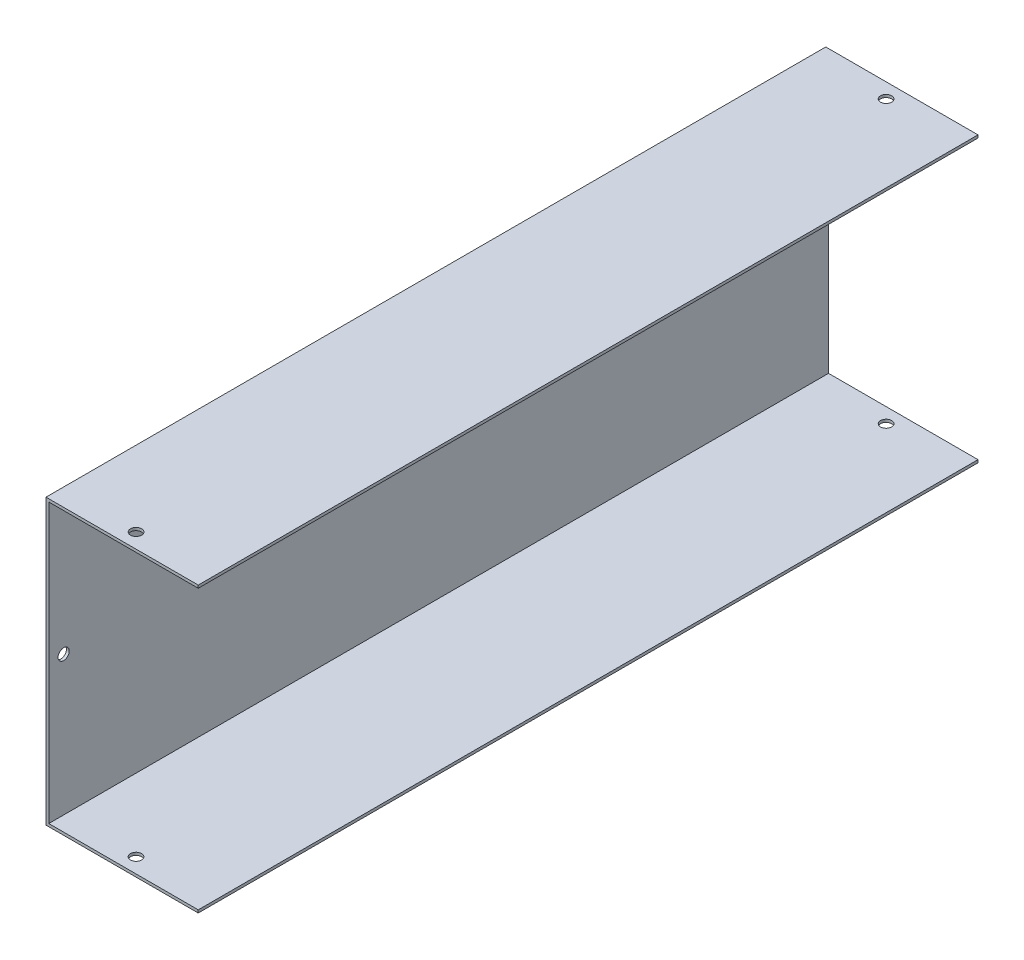
from build123d import *

# Parameters (mm, degrees)
SKETCH1_W           = 82
SKETCH1_H           = 153
BOSS_EXTRUDE1_DEPTH = 420
SHELL1_T            = -1.5
SKETCH4_R           = 3
CUT_EXTRUDE1_DEPTH  = 154
CUT_EXTRUDE2_REACH  = 436.714
SKETCH5_R           = 3


with BuildPart() as part:
    # Sketch1 → Boss-Extrude1 (new body)
    with BuildSketch(Plane.XY):
        Rectangle(SKETCH1_W, SKETCH1_H)
    extrude(amount=BOSS_EXTRUDE1_DEPTH)

    # Shell1
    shell1_openings = [part.faces().sort_by_distance(p)[0] for p in [
        (0, 0, 0),
        (41, 0, 210),
        (0, 0, 420),
    ]]
    offset(amount=SHELL1_T, openings=shell1_openings, kind=Kind.INTERSECTION)

    # Sketch4 → Cut-Extrude1 (cut)
    with BuildSketch(Plane(origin=(0, 76.5, 0), x_dir=(1, 0, 0), z_dir=(0, 1, 0))):
        with Locations((-0.5, -8)):
            Circle(SKETCH4_R)
        with Locations((-0.5, -412)):
            Circle(SKETCH4_R)
    extrude(amount=-CUT_EXTRUDE1_DEPTH, mode=Mode.SUBTRACT)

    # Sketch5 → Cut-Extrude2 (cut, up to next)
    with BuildSketch(Plane.ZY.offset(41), mode=Mode.PRIVATE) as cut_extrude2_sk1:
        with Locations((8, 0)):
            Circle(SKETCH5_R)
    cut_extrude2_tool1 = extrude(cut_extrude2_sk1.sketch, amount=-CUT_EXTRUDE2_REACH, mode=Mode.PRIVATE) & part.part
    # Sketch5 → Cut-Extrude2 (cut, up to next)
    with BuildSketch(Plane.ZY.offset(41), mode=Mode.PRIVATE) as cut_extrude2_sk2:
        with Locations((412, 0)):
            Circle(SKETCH5_R)
    cut_extrude2_tool2 = extrude(cut_extrude2_sk2.sketch, amount=-CUT_EXTRUDE2_REACH, mode=Mode.PRIVATE) & part.part
    add(cut_extrude2_tool1.solids().sort_by_distance((-41, 0, 8))[0], mode=Mode.SUBTRACT)
    add(cut_extrude2_tool2.solids().sort_by_distance((-41, 0, 412))[0], mode=Mode.SUBTRACT)


solid = part.part
